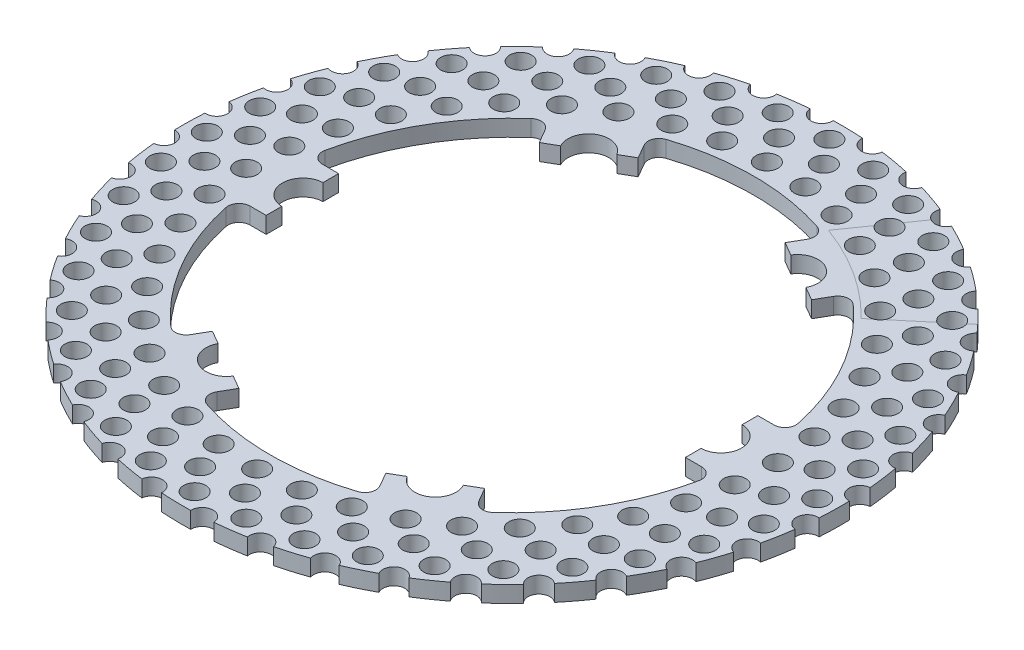
from build123d import *

# Parameters (mm, degrees)
SKETCH1_R           = 95.25
SKETCH1_R_2         = 57.15
BOSS_EXTRUDE1_DEPTH = 4.7625
HAT_AREA_DEPTH      = 4.7625
CIRPATTERN1_COUNT   = 6
CUT_EXTRUDE2_DEPTH  = 4.7625
CIRPATTERN2_COUNT   = 6
FILLET_INNER_R      = 3.175
SKETCH4_R           = 3.175
ROTOR_HOLE_DEPTH    = 4.7625
CIRPATTERN3_COUNT   = 40


with BuildPart() as part:
    # Sketch1 → Boss-Extrude1 (new body)
    with BuildSketch(Plane(origin=(0, 0, 0), x_dir=(1, 0, 0), z_dir=(0, 1, 0))):
        with Locations(Location((0, 0, 0), (0, 0, 90))):
            Circle(SKETCH1_R)
        with Locations(Location((0, 0, 0), (0, 0, 90))):
            Circle(SKETCH1_R_2, mode=Mode.SUBTRACT)
    extrude(amount=BOSS_EXTRUDE1_DEPTH)

    # Sketch2 → Hat Area (cut)
    with BuildSketch(Plane(origin=(0, 4.7625, 0), x_dir=(1, 0, 0), z_dir=(0, 1, 0))):
        with BuildLine():
            Line((-60.5917, 10.4648), (-60.5917, 5.950469261))
            ThreePointArc((-60.5917, 5.950469261), (-66.367025, 0), (-60.5917, -5.950469261))
            Line((-60.5917, -5.950469261), (-60.5917, -10.4648))
            Line((-60.5917, -10.4648), (-52.9717, -10.4648))
            Line((-52.9717, -10.4648), (-52.9717, 10.4648))
            Line((-52.9717, 10.4648), (-60.5917, 10.4648))
        make_face()
    hat_area = extrude(amount=-HAT_AREA_DEPTH, mode=Mode.SUBTRACT)

    # CirPattern1: Hat Area ×6 about axis
    cirpattern1_axis = Axis((0, 0, 0), (0, 1, 0))
    for i in range(1, CIRPATTERN1_COUNT):
        add(hat_area.rotate(cirpattern1_axis, i * 360 / CIRPATTERN1_COUNT), mode=Mode.SUBTRACT)

    # Sketch3 → Cut-Extrude2 (cut)
    with BuildSketch(Plane(origin=(0, 4.7625, 0), x_dir=(1, 0, 0), z_dir=(0, 1, 0))):
        with BuildLine():
            Line((-69.061642472, 10.4648), (-18.125565291, 10.4648))
            Line((-18.125565291, 10.4648), (-43.593603882, 54.576736808))
            ThreePointArc((-43.593603882, 54.576736808), (-60.491874454, 34.925), (-69.061642472, 10.4648))
        make_face()
    cut_extrude2 = extrude(amount=-CUT_EXTRUDE2_DEPTH, mode=Mode.SUBTRACT)

    # CirPattern2: Cut-Extrude2 ×6 about axis
    cirpattern2_axis = Axis((0, 0, 0), (0, 1, 0))
    for i in range(1, CIRPATTERN2_COUNT):
        add(cut_extrude2.rotate(cirpattern2_axis, i * 360 / CIRPATTERN2_COUNT), mode=Mode.SUBTRACT)

    # Fillet Inner
    fillet_inner_edges = [part.edges().sort_by_distance(p)[0] for p in [
        (-43.593603882, 2.38125, -54.576736808),
        (-69.061642472, 2.38125, -10.4648),
        (69.061642472, 2.38125, -10.4648),
        (43.593603882, 2.38125, -54.576736808),
        (25.468038591, 2.38125, -65.041536808),
        (-25.468038591, 2.38125, -65.041536808),
        (-25.468038591, 2.38125, 65.041536808),
        (25.468038591, 2.38125, 65.041536808),
        (43.593603882, 2.38125, 54.576736808),
        (69.061642472, 2.38125, 10.4648),
        (-69.061642472, 2.38125, 10.4648),
        (-43.593603882, 2.38125, 54.576736808),
    ]]
    fillet(fillet_inner_edges, radius=FILLET_INNER_R)

    # Sketch4 → Rotor Hole (cut)
    with BuildSketch(Plane(origin=(0, 4.7625, 0), x_dir=(1, 0, 0), z_dir=(0, 1, 0))):
        with Locations(Location((-1.585301312, 75.260373859, 0), (0, 0, 270))):
            Circle(SKETCH4_R)
        with Locations((-20.32, 93.057294717)):
            Circle(SKETCH4_R)
        with Locations(Location((-12.337179841, 89.144919183, 0), (0, 0, 270))):
            Circle(SKETCH4_R)
        with Locations(Location((-5.861059242, 83.054602116, 0), (0, 0, 270))):
            Circle(SKETCH4_R)
    rotor_hole = extrude(amount=-ROTOR_HOLE_DEPTH, mode=Mode.SUBTRACT)

    # CirPattern3: Rotor Hole ×40 about axis
    cirpattern3_axis = Axis((0, 0, 0), (0, 1, 0))
    for i in range(1, CIRPATTERN3_COUNT):
        add(rotor_hole.rotate(cirpattern3_axis, i * 360 / CIRPATTERN3_COUNT), mode=Mode.SUBTRACT)


solid = part.part
